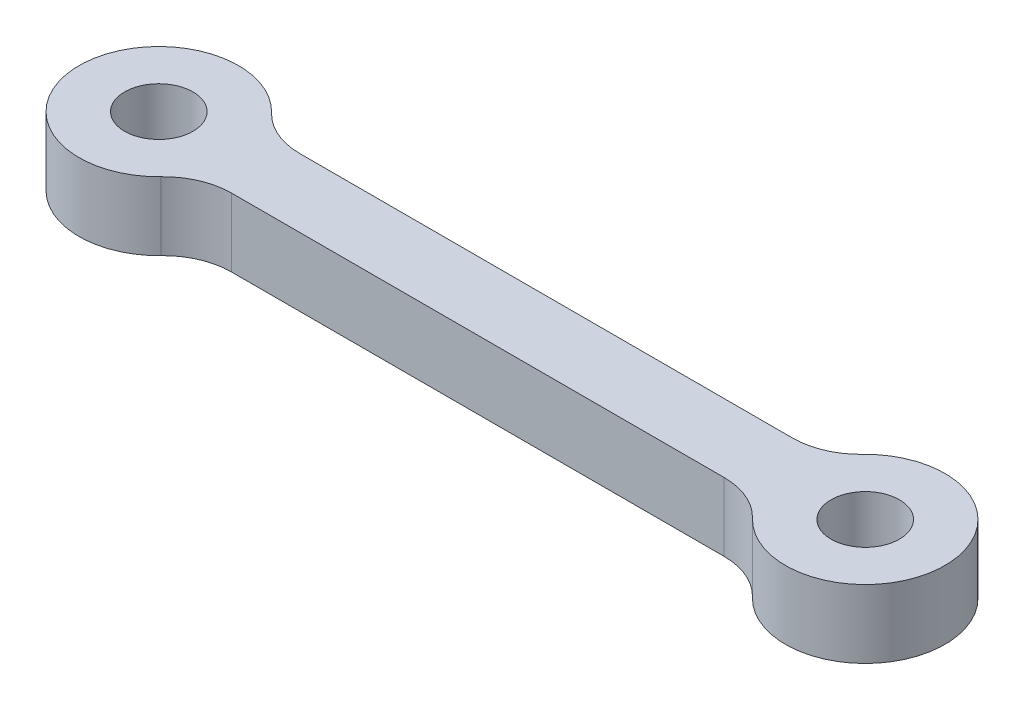
from build123d import *

# Parameters (mm, degrees)
IZIM2_R                     = 1.5
Y_KSEKLIK_EKSTR_ZYON1_DEPTH = 3
RADYUS1_R                   = 3


with BuildPart() as part:
    # Çizim2 → Yükseklik-Ekstrüzyon1 (new body)
    with BuildSketch(Plane(origin=(0, 0, 0), x_dir=(1, 0, 0), z_dir=(0, 1, 0))):
        with BuildLine():
            Line((-12.33772234, 1.5), (12.33772234, 1.5))
            ThreePointArc((12.33772234, 1.5), (19, 0), (12.33772234, -1.5))
            Line((12.33772234, -1.5), (-12.33772234, -1.5))
            ThreePointArc((-12.33772234, -1.5), (-19, 0), (-12.33772234, 1.5))
        make_face()
        with Locations(Location((15.5, 0, 0), (0, 0, 270))):
            Circle(IZIM2_R, mode=Mode.SUBTRACT)
        with Locations(Location((-15.5, 0, 0), (0, 0, 270))):
            Circle(IZIM2_R, mode=Mode.SUBTRACT)
    extrude(amount=Y_KSEKLIK_EKSTR_ZYON1_DEPTH)

    # Radyus1
    radyus1_edges = [part.edges().sort_by_distance(p)[0] for p in [
        (12.33772234, 1.5, 1.5),
        (-12.33772234, 1.5, 1.5),
        (-12.33772234, 1.5, -1.5),
        (12.33772234, 1.5, -1.5),
    ]]
    fillet(radyus1_edges, radius=RADYUS1_R)


solid = part.part
